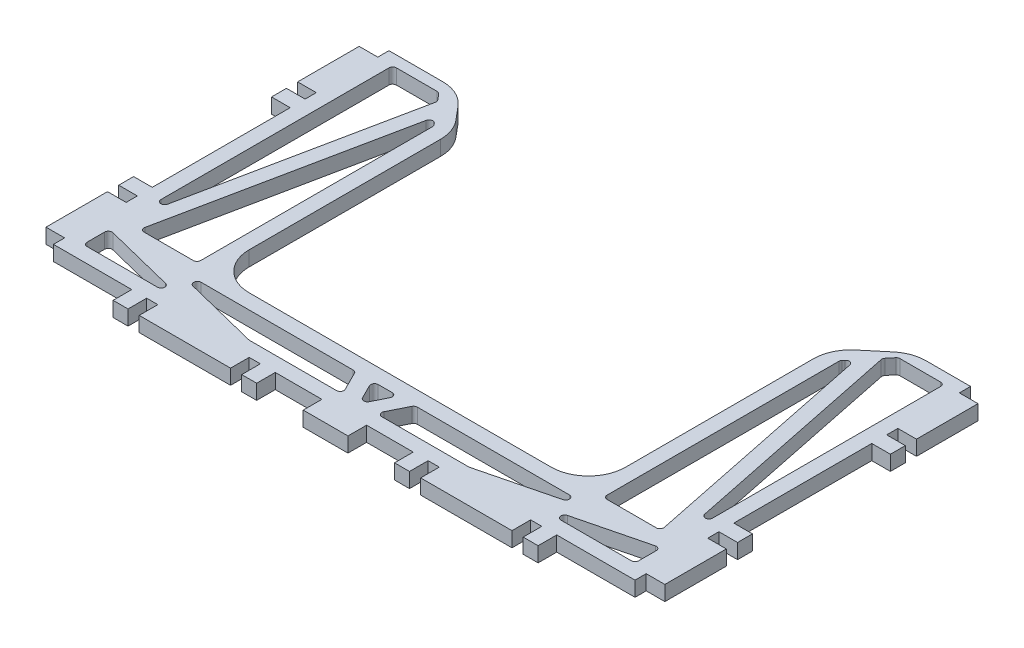
from build123d import *

# Parameters (mm, degrees)
SKETCH1_W           = 5
SKETCH1_H           = 16.5
SKETCH1_W_2         = 12
SKETCH1_H_2         = 5
SKETCH1_H_3         = 4
SKETCH1_W_3         = 24.5
SKETCH1_W_4         = 4
BOSS_EXTRUDE1_DEPTH = 4
FILLET1_R           = 10
FILLET2_R           = 1


with BuildPart() as part:
    # Sketch1 → Boss-Extrude1 (new body)
    # profile 1 of 16: a face of its own
    with BuildSketch(Plane(origin=(0, 0, 0), x_dir=(1, 0, 0), z_dir=(0, 1, 0))):
        Polygon((-78, 42.5), (-58.890996312, 42.5), (-50.5, 32.5), (-50.5, -32.5), (50.5, -32.5), (50.5, 32.5), (62.417535926, 42.5), (78, 42.5), (78, -47.5), (-78, -47.5), align=None)
        Polygon((-74, 39.5), (-61.595326576, 39.5), (-59.688086754, 37.22704009), (-74, -32.5), align=None, mode=Mode.SUBTRACT)
        Polygon((-56.407239822, 33.317078972), (-54.5, 31.044119063), (-54.5, -32.5), (-69.916608972, -32.5), align=None, mode=Mode.SUBTRACT)
        Polygon((-74, -36.5), (-74, -43.5), (-45.997033515, -43.5), align=None, mode=Mode.SUBTRACT)
        Polygon((-57.50593297, -36.5), (-7.972135955, -36.5), (-4.472135955, -43.5), (-29.502966485, -43.5), align=None, mode=Mode.SUBTRACT)
        Polygon((3.5, -36.5), (-3.5, -36.5), (0, -43.5), align=None, mode=Mode.SUBTRACT)
        Polygon((4.472135955, -43.5), (29.502966485, -43.5), (57.50593297, -36.5), (7.972135955, -36.5), align=None, mode=Mode.SUBTRACT)
        Polygon((74, -43.5), (45.997033515, -43.5), (74, -36.5), align=None, mode=Mode.SUBTRACT)
        Polygon((54.5, -32.5), (69.916608972, -32.5), (56.407239822, 33.317078972), (54.5, 31.044119063), align=None, mode=Mode.SUBTRACT)
        Polygon((59.688086754, 37.22704009), (74, -32.5), (74, 39.5), (61.595326576, 39.5), align=None, mode=Mode.SUBTRACT)
    # profile 2 of 16: a face of its own
    with BuildSketch(Plane(origin=(0, 0, 0), x_dir=(1, 0, 0), z_dir=(0, 1, 0))):
        with Locations((80.5, 31.25)):
            Rectangle(SKETCH1_W, SKETCH1_H)
    # profile 3 of 16: a face of its own
    with BuildSketch(Plane(origin=(0, 0, 0), x_dir=(1, 0, 0), z_dir=(0, 1, 0))):
        with Locations((80.5, -36.25)):
            Rectangle(SKETCH1_W, SKETCH1_H)
    # profile 4 of 16: a face of its own
    with BuildSketch(Plane(origin=(0, 0, 0), x_dir=(1, 0, 0), z_dir=(0, 1, 0))):
        with Locations((0, -50)):
            Rectangle(SKETCH1_W_2, SKETCH1_H_2)
    # profile 5 of 16: a face of its own
    with BuildSketch(Plane(origin=(0, 0, 0), x_dir=(1, 0, 0), z_dir=(0, 1, 0))):
        with Locations((80.5, 18)):
            Rectangle(SKETCH1_W, SKETCH1_H_3)
    # profile 6 of 16: a face of its own
    with BuildSketch(Plane(origin=(0, 0, 0), x_dir=(1, 0, 0), z_dir=(0, 1, 0))):
        with Locations((80.5, -23)):
            Rectangle(SKETCH1_W, SKETCH1_H_3)
    # profile 7 of 16: a face of its own
    with BuildSketch(Plane(origin=(0, 0, 0), x_dir=(1, 0, 0), z_dir=(0, 1, 0))):
        with Locations((37.75, -50)):
            Rectangle(SKETCH1_W_3, SKETCH1_H_2)
    # profile 8 of 16: a face of its own
    with BuildSketch(Plane(origin=(0, 0, 0), x_dir=(1, 0, 0), z_dir=(0, 1, 0))):
        with Locations((55, -50)):
            Rectangle(SKETCH1_W_4, SKETCH1_H_2)
    # profile 9 of 16: a face of its own
    with BuildSketch(Plane(origin=(0, 0, 0), x_dir=(1, 0, 0), z_dir=(0, 1, 0))):
        with Locations((20.5, -50)):
            Rectangle(SKETCH1_W_4, SKETCH1_H_2)
    # profile 10 of 16: a face of its own
    with BuildSketch(Plane(origin=(0, 0, 0), x_dir=(1, 0, 0), z_dir=(0, 1, 0))):
        with Locations((-20.5, -50)):
            Rectangle(SKETCH1_W_4, SKETCH1_H_2)
    # profile 11 of 16: a face of its own
    with BuildSketch(Plane(origin=(0, 0, 0), x_dir=(1, 0, 0), z_dir=(0, 1, 0))):
        with Locations((-37.75, -50)):
            Rectangle(SKETCH1_W_3, SKETCH1_H_2)
    # profile 12 of 16: a face of its own
    with BuildSketch(Plane(origin=(0, 0, 0), x_dir=(1, 0, 0), z_dir=(0, 1, 0))):
        with Locations((-55, -50)):
            Rectangle(SKETCH1_W_4, SKETCH1_H_2)
    # profile 13 of 16: a face of its own
    with BuildSketch(Plane(origin=(0, 0, 0), x_dir=(1, 0, 0), z_dir=(0, 1, 0))):
        with Locations((-80.5, -36.25)):
            Rectangle(SKETCH1_W, SKETCH1_H)
    # profile 14 of 16: a face of its own
    with BuildSketch(Plane(origin=(0, 0, 0), x_dir=(1, 0, 0), z_dir=(0, 1, 0))):
        with Locations((-80.5, -23)):
            Rectangle(SKETCH1_W, SKETCH1_H_3)
    # profile 15 of 16: a face of its own
    with BuildSketch(Plane(origin=(0, 0, 0), x_dir=(1, 0, 0), z_dir=(0, 1, 0))):
        with Locations((-80.5, 18)):
            Rectangle(SKETCH1_W, SKETCH1_H_3)
    # profile 16 of 16: a face of its own
    with BuildSketch(Plane(origin=(0, 0, 0), x_dir=(1, 0, 0), z_dir=(0, 1, 0))):
        with Locations((-80.5, 31.25)):
            Rectangle(SKETCH1_W, SKETCH1_H)
    extrude(amount=BOSS_EXTRUDE1_DEPTH)

    # Fillet1
    fillet1_edges = [part.edges().sort_by_distance(p)[0] for p in [
        (-58.890996312, 2, -42.5),
        (-50.5, 2, -32.5),
        (-50.5, 2, 32.5),
        (50.5, 2, 32.5),
        (50.5, 2, -32.5),
        (62.417535926, 2, -42.5),
    ]]
    fillet(fillet1_edges, radius=FILLET1_R)

    # Fillet2
    fillet2_edges = [part.edges().sort_by_distance(p)[0] for p in [
        (74, 2, 43.5),
        (74, 2, 36.5),
        (45.997033515, 2, 43.5),
        (-3.5, 2, 36.5),
        (0, 2, 43.5),
        (3.5, 2, 36.5),
        (-4.472135955, 2, 43.5),
        (-7.972135955, 2, 36.5),
        (-57.50593297, 2, 36.5),
        (-29.502966485, 2, 43.5),
        (-54.5, 2, 32.5),
        (-54.5, 2, -31.044119063),
        (-56.407239822, 2, -33.317078972),
        (-69.916608972, 2, 32.5),
        (-59.688086754, 2, -37.22704009),
        (-61.595326576, 2, -39.5),
        (-74, 2, -39.5),
        (-74, 2, 32.5),
        (-74, 2, 36.5),
        (-74, 2, 43.5),
        (-45.997033515, 2, 43.5),
        (57.50593297, 2, 36.5),
        (7.972135955, 2, 36.5),
        (4.472135955, 2, 43.5),
        (29.502966485, 2, 43.5),
        (56.407239822, 2, -33.317078972),
        (54.5, 2, -31.044119063),
        (54.5, 2, 32.5),
        (69.916608972, 2, 32.5),
        (74, 2, -39.5),
        (61.595326576, 2, -39.5),
        (59.688086754, 2, -37.22704009),
        (74, 2, 32.5),
    ]]
    fillet(fillet2_edges, radius=FILLET2_R)


solid = part.part
